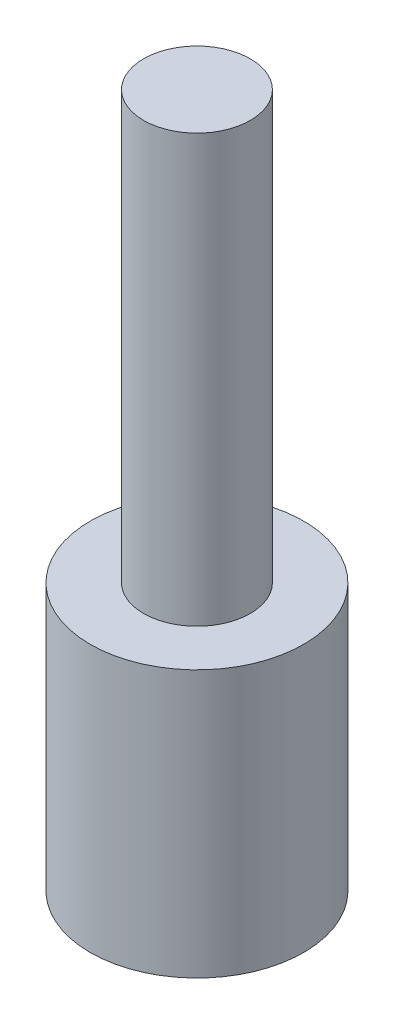
from build123d import *

# Parameters (mm, degrees)
SKETCH1_R           = 20
BOSS_EXTRUDE1_DEPTH = 50
SKETCH2_R           = 10
BOSS_EXTRUDE2_DEPTH = 80


with BuildPart() as part:
    # Sketch1 → Boss-Extrude1 (new body)
    with BuildSketch(Plane(origin=(0, 0, 0), x_dir=(1, 0, 0), z_dir=(0, 1, 0))):
        with Locations(Location((0, 0, 0), (0, 0, 270))):
            Circle(SKETCH1_R)
    extrude(amount=BOSS_EXTRUDE1_DEPTH)

    # Sketch2 → Boss-Extrude2 (add)
    with BuildSketch(Plane(origin=(0, 50, 0), x_dir=(1, 0, 0), z_dir=(0, 1, 0))):
        with Locations(Location((0, 0, 0), (0, 0, 270))):
            Circle(SKETCH2_R)
    extrude(amount=BOSS_EXTRUDE2_DEPTH)


solid = part.part
